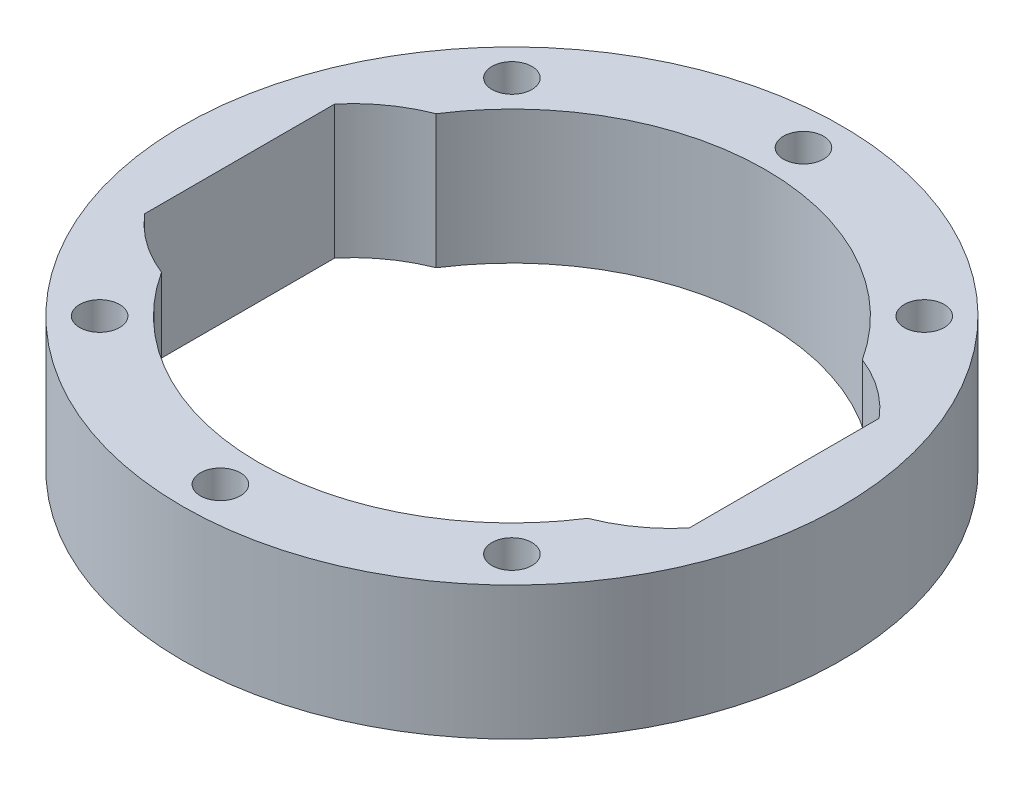
from build123d import *

# Parameters (mm, degrees)
SKETCH2_R           = 49.4
BOSS_EXTRUDE1_DEPTH = 20
SKETCH2_9_R         = 3
CUT_EXTRUDE1_DEPTH  = 20


with BuildPart() as part:
    # Sketch2 → Boss-Extrude1 (new body)
    with BuildSketch(Plane(origin=(0, 0, 0), x_dir=(1, 0, 0), z_dir=(0, 1, 0))):
        Circle(SKETCH2_R)
        with BuildLine():
            Line((-40.8, 14.240786495), (-40.8, -14.240786495))
            ThreePointArc((-40.8, -14.240786495), (-36.767834145, -17.967438449), (-31.941422594, -20.585080099))
            ThreePointArc((-31.941422594, -20.585080099), (0, -38), (31.941422594, -20.585080099))
            ThreePointArc((31.941422594, -20.585080099), (36.767834145, -17.967438449), (40.8, -14.240786495))
            Line((40.8, -14.240786495), (40.8, 14.240786495))
            ThreePointArc((40.8, 14.240786495), (36.767834145, 17.967438449), (31.941422594, 20.585080099))
            ThreePointArc((31.941422594, 20.585080099), (0, 38), (-31.941422594, 20.585080099))
            ThreePointArc((-31.941422594, 20.585080099), (-36.767834145, 17.967438449), (-40.8, 14.240786495))
        make_face(mode=Mode.SUBTRACT)
    extrude(amount=BOSS_EXTRUDE1_DEPTH)

    # Sketch2<9> → Cut-Extrude1 (cut)
    with BuildSketch(Plane(origin=(0, 0, 0), x_dir=(1, 0, 0), z_dir=(0, 1, 0))):
        with Locations((0, 43.7)):
            Circle(SKETCH2_9_R)
        with Locations((30.900566338, 30.900566338)):
            Circle(SKETCH2_9_R)
        with Locations((30.900566338, -30.900566338)):
            Circle(SKETCH2_9_R)
        with Locations((0, -43.7)):
            Circle(SKETCH2_9_R)
        with Locations((-30.900566338, -30.900566338)):
            Circle(SKETCH2_9_R)
        with Locations((-30.900566338, 30.900566338)):
            Circle(SKETCH2_9_R)
    extrude(amount=CUT_EXTRUDE1_DEPTH, mode=Mode.SUBTRACT)


solid = part.part
